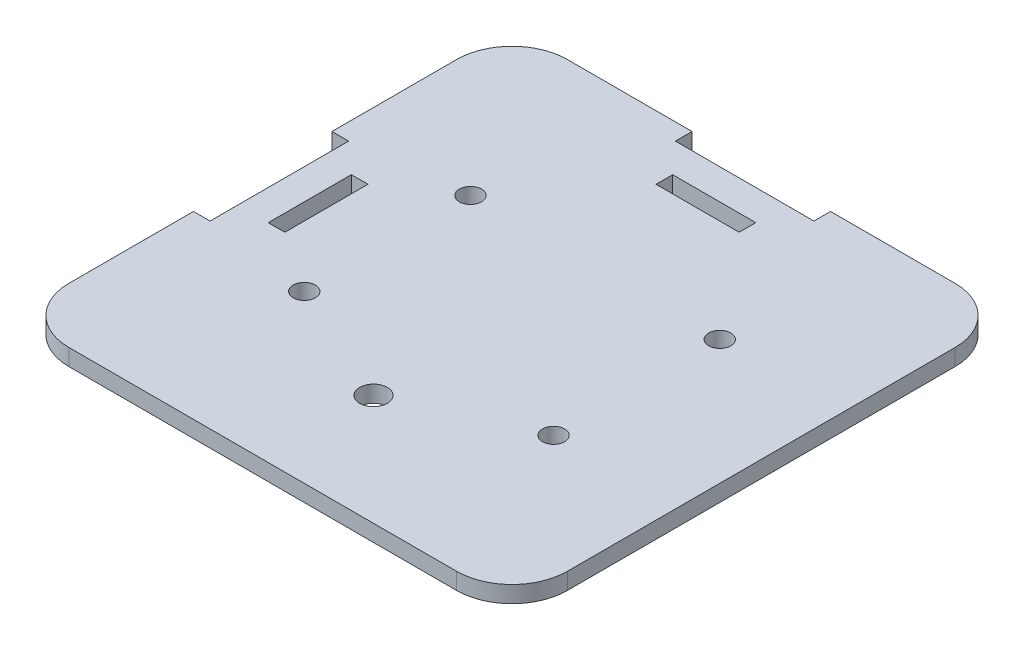
from build123d import *

# Parameters (mm, degrees)
BOSS_EXTRUDE1_DEPTH = 3
SKETCH2_R           = 2
CUT_EXTRUDE1_DEPTH  = 3
SKETCH3_W           = 15
SKETCH3_H           = 3
SKETCH3_W_2         = 3
SKETCH3_H_2         = 15
CUT_EXTRUDE2_DEPTH  = 10
SKETCH4_R           = 2.5
CUT_EXTRUDE3_DEPTH  = 14


with BuildPart() as part:
    # Sketch1 → Boss-Extrude1 (new body)
    with BuildSketch(Plane(origin=(0, 0, 0), x_dir=(1, 0, 0), z_dir=(0, 1, 0))):
        with BuildLine():
            Line((-35, -45), (35, -45))
            ThreePointArc((35, -45), (42.071067812, -42.071067812), (45, -35))
            Line((45, -35), (45, 35))
            ThreePointArc((45, 35), (42.071067812, 42.071067812), (35, 45))
            Line((35, 45), (12.5, 45))
            Line((12.5, 45), (12.5, 42))
            Line((12.5, 42), (-12.5, 42))
            Line((-12.5, 42), (-12.5, 45))
            Line((-12.5, 45), (-35, 45))
            ThreePointArc((-35, 45), (-42.071067812, 42.071067812), (-45, 35))
            Line((-45, 35), (-45, 12.5))
            Line((-45, 12.5), (-42, 12.5))
            Line((-42, 12.5), (-42, -12.5))
            Line((-42, -12.5), (-45, -12.5))
            Line((-45, -12.5), (-45, -35))
            ThreePointArc((-45, -35), (-42.071067812, -42.071067812), (-35, -45))
        make_face()
    extrude(amount=BOSS_EXTRUDE1_DEPTH)

    # Sketch2 → Cut-Extrude1 (cut)
    with BuildSketch(Plane(origin=(0, 3, 0), x_dir=(1, 0, 0), z_dir=(0, 1, 0))):
        with Locations(Location((-22.5, 15, 0), (0, 0, 270))):
            Circle(SKETCH2_R)
        with Locations(Location((22.5, 15, 0), (0, 0, 90))):
            Circle(SKETCH2_R)
        with Locations(Location((22.5, -15, 0), (0, 0, 270))):
            Circle(SKETCH2_R)
        with Locations(Location((-22.5, -15, 0), (0, 0, 90))):
            Circle(SKETCH2_R)
    extrude(amount=-CUT_EXTRUDE1_DEPTH, mode=Mode.SUBTRACT)

    # Sketch3 → Cut-Extrude2 (cut)
    with BuildSketch(Plane(origin=(0, 3, 0), x_dir=(1, 0, 0), z_dir=(0, 1, 0))):
        with Locations((0, 35)):
            Rectangle(SKETCH3_W, SKETCH3_H)
        with Locations((-35, 0)):
            Rectangle(SKETCH3_W_2, SKETCH3_H_2)
    extrude(amount=-CUT_EXTRUDE2_DEPTH, mode=Mode.SUBTRACT)

    # Sketch4 → Cut-Extrude3 (cut)
    with BuildSketch(Plane(origin=(0, 3, 0), x_dir=(1, 0, 0), z_dir=(0, 1, 0))):
        with Locations(Location((0, -25, 0), (0, 0, 270))):
            Circle(SKETCH4_R)
    extrude(amount=-CUT_EXTRUDE3_DEPTH, mode=Mode.SUBTRACT)


solid = part.part
